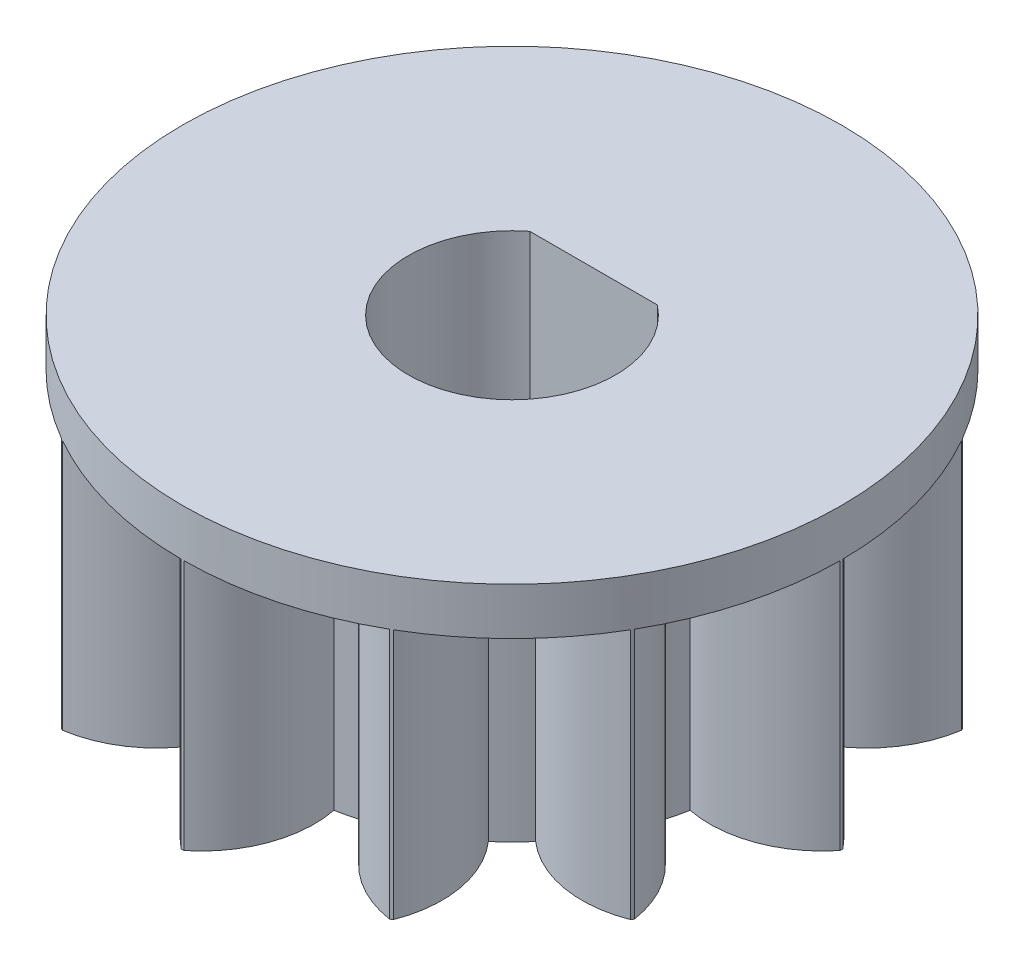
from build123d import *

# Parameters (mm, degrees)
BOSS_EXTRUDE2_DEPTH = 8
CIRPATTERN4_COUNT   = 12
CUT_EXTRUDE1_DEPTH  = 17.867127793
SKETCH8_R           = 10.5
BOSS_EXTRUDE3_DEPTH = 1.5


with BuildPart() as part:
    # Sketch6 → Boss-Extrude2 (new body)
    with BuildSketch(Plane(origin=(0, 0, 0), x_dir=(-1, 0, 0), z_dir=(0, 1, 0))):
        with BuildLine():
            Line((-1.844085696, 6.882221512), (-0.258819045, 0.965925826))
            ThreePointArc((-0.258819045, 0.965925826), (0, 1), (0.258819045, 0.965925826))
            Line((0.258819045, 0.965925826), (1.844085696, 6.882221512))
            ThreePointArc((1.844085696, 6.882221512), (1.585602155, 6.946329305), (1.324903403, 7.000732531))
            ThreePointArc((1.324903403, 7.000732531), (1.172594993, 8.928869546), (0.0444307, 10.499905995))
            ThreePointArc((0.0444307, 10.499905995), (0, 10.5), (-0.0444307, 10.499905995))
            ThreePointArc((-0.0444307, 10.499905995), (-1.172594993, 8.928869546), (-1.324903403, 7.000732531))
            ThreePointArc((-1.324903403, 7.000732531), (-1.585602155, 6.946329305), (-1.844085696, 6.882221512))
        make_face()
    boss_extrude2 = extrude(amount=BOSS_EXTRUDE2_DEPTH)

    # CirPattern4: Boss-Extrude2 ×12 about axis
    cirpattern4_axis = Axis((0, 20.85, 0), (0, -1, 0))
    for i in range(1, CIRPATTERN4_COUNT):
        add(boss_extrude2.rotate(cirpattern4_axis, i * 360 / CIRPATTERN4_COUNT))

    # Sketch7 → Cut-Extrude1 (cut, through all)
    with BuildSketch(Plane(origin=(0, 8, 0), x_dir=(1, 0, 0), z_dir=(0, 1, 0))):
        with BuildLine():
            Line((2.032240143, 2.6), (-2.032240143, 2.6))
            ThreePointArc((-2.032240143, 2.6), (0, -3.3), (2.032240143, 2.6))
        make_face()
    extrude(amount=-CUT_EXTRUDE1_DEPTH, mode=Mode.SUBTRACT)

    # Sketch8 → Boss-Extrude3 (add)
    with BuildSketch(Plane(origin=(0, 8, 0), x_dir=(1, 0, 0), z_dir=(0, 1, 0))):
        Circle(SKETCH8_R)
        with BuildLine():
            Line((2.032240143, 2.6), (-2.032240143, 2.6))
            ThreePointArc((-2.032240143, 2.6), (0, -3.3), (2.032240143, 2.6))
        make_face(mode=Mode.SUBTRACT)
    extrude(amount=BOSS_EXTRUDE3_DEPTH)


solid = part.part
